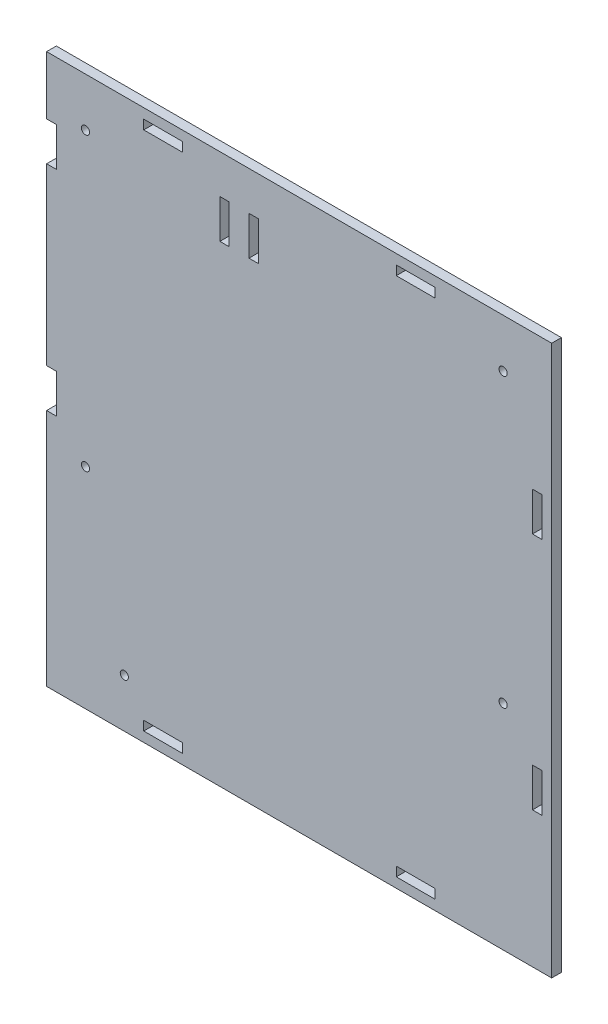
from build123d import *

# Parameters (mm, degrees)
SKETCH1_W           = 260
SKETCH1_H           = 283
SKETCH1_W_2         = 20
SKETCH1_H_2         = 4.8
SKETCH1_W_3         = 4.8
SKETCH1_H_3         = 20
BOSS_EXTRUDE1_DEPTH = 5
SKETCH2_W           = 4.8
SKETCH2_H           = 20
CUT_EXTRUDE1_DEPTH  = 5
SKETCH3_R           = 2.1
CUT_EXTRUDE2_DEPTH  = 5
SKETCH4_R           = 2.1
CUT_EXTRUDE3_DEPTH  = 5
SKETCH5_R           = 2.1
CUT_EXTRUDE4_DEPTH  = 5
SKETCH6_R           = 2.1
CUT_EXTRUDE5_DEPTH  = 5
SKETCH7_W           = 5
SKETCH7_H           = 20
CUT_EXTRUDE6_DEPTH  = 10


with BuildPart() as part:
    # Sketch1 → Boss-Extrude1 (new body)
    with BuildSketch(Plane.XY):
        with Locations((-120, 136.5)):
            Rectangle(SKETCH1_W, SKETCH1_H)
        with Locations((-190, 2.5)):
            Rectangle(SKETCH1_W_2, SKETCH1_H_2, mode=Mode.SUBTRACT)
        with Locations((-60, 2.5)):
            Rectangle(SKETCH1_W_2, SKETCH1_H_2, mode=Mode.SUBTRACT)
        with Locations((2.5, 75)):
            Rectangle(SKETCH1_W_3, SKETCH1_H_3, mode=Mode.SUBTRACT)
        with Locations((2.5, 198)):
            Rectangle(SKETCH1_W_3, SKETCH1_H_3, mode=Mode.SUBTRACT)
        with Locations((-60, 270.5)):
            Rectangle(SKETCH1_W_2, SKETCH1_H_2, mode=Mode.SUBTRACT)
        with Locations((-190, 270.5)):
            Rectangle(SKETCH1_W_2, SKETCH1_H_2, mode=Mode.SUBTRACT)
    extrude(amount=BOSS_EXTRUDE1_DEPTH)

    # Sketch2 → Cut-Extrude1 (cut)
    with BuildSketch(Plane.XY.offset(5)):
        with Locations((-143.405234687, 248)):
            Rectangle(SKETCH2_W, SKETCH2_H)
        with Locations((-158.405234687, 248)):
            Rectangle(SKETCH2_W, SKETCH2_H)
    extrude(amount=-CUT_EXTRUDE1_DEPTH, mode=Mode.SUBTRACT)

    # Sketch3 → Cut-Extrude2 (cut)
    with BuildSketch(Plane.XY.offset(5)):
        with Locations((-230, 253)):
            Circle(SKETCH3_R)
        with Locations((-15, 253)):
            Circle(SKETCH3_R)
    extrude(amount=-CUT_EXTRUDE2_DEPTH, mode=Mode.SUBTRACT)

    # Sketch4 → Cut-Extrude3 (cut)
    with BuildSketch(Plane.XY.offset(5)):
        with Locations((-210, 20)):
            Circle(SKETCH4_R)
    extrude(amount=-CUT_EXTRUDE3_DEPTH, mode=Mode.SUBTRACT)

    # Sketch5 → Cut-Extrude4 (cut)
    with BuildSketch(Plane.XY.offset(5)):
        with Locations((-15, 105)):
            Circle(SKETCH5_R)
    extrude(amount=-CUT_EXTRUDE4_DEPTH, mode=Mode.SUBTRACT)

    # Sketch6 → Cut-Extrude5 (cut)
    with BuildSketch(Plane.XY.offset(5)):
        with Locations((-230, 103)):
            Circle(SKETCH6_R)
    extrude(amount=-CUT_EXTRUDE5_DEPTH, mode=Mode.SUBTRACT)

    # Sketch7 → Cut-Extrude6 (cut)
    with BuildSketch(Plane.XY.offset(5)):
        with Locations((-247.5, 238)):
            Rectangle(SKETCH7_W, SKETCH7_H)
        with Locations((-247.5, 128)):
            Rectangle(SKETCH7_W, SKETCH7_H)
    extrude(amount=-CUT_EXTRUDE6_DEPTH, mode=Mode.SUBTRACT)


solid = part.part
